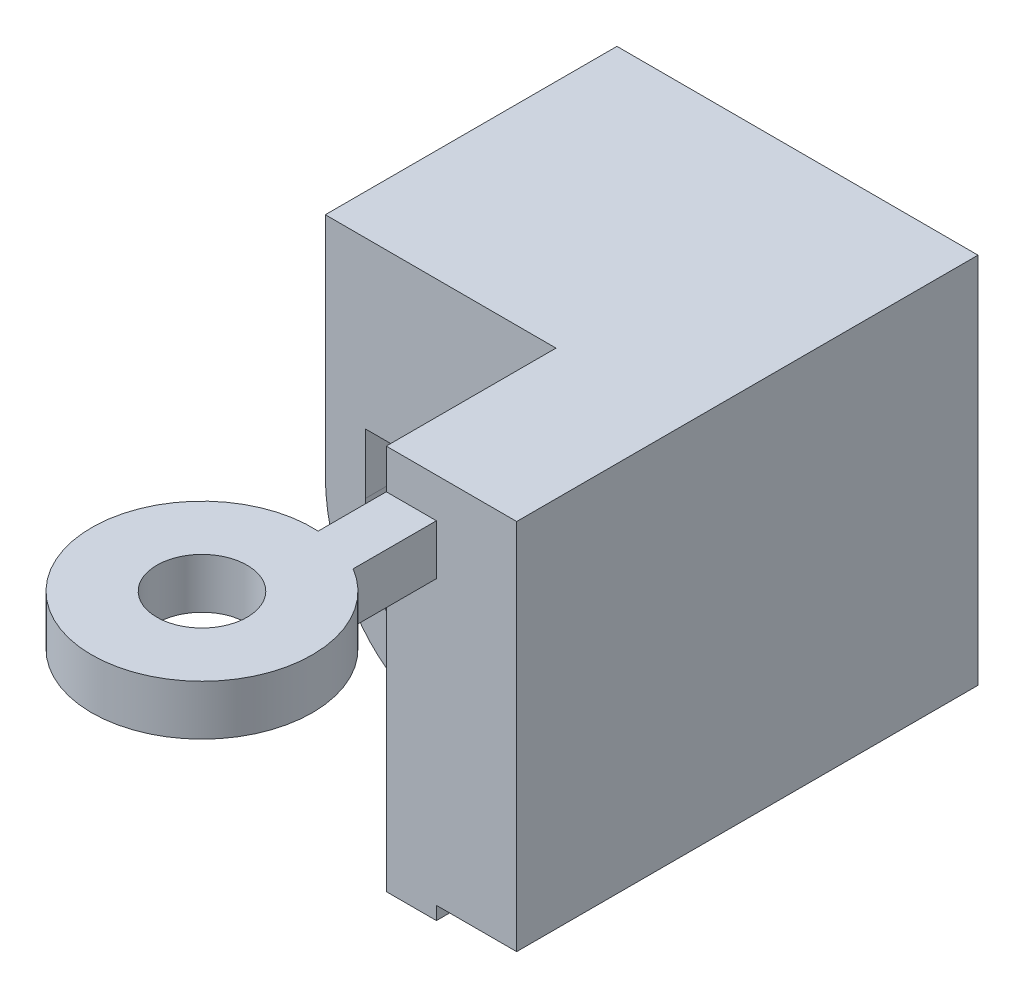
from build123d import *

# Parameters (mm, degrees)
BOSS_EXTRUDE1_DEPTH     = 46
SKETCH3_W               = 23
SKETCH3_H               = 15
CUT_EXTRUDE2_DEPTH      = 28
CUT_EXTRUDE6_DEPTH      = 40
CUT_EXTRUDE6_DEPTH_BACK = 30
SKETCH10_W              = 22.999996183
SKETCH10_H              = 16.921181255
SKETCH7_R               = 11
SKETCH7_R_2             = 4.5
BOSS_EXTRUDE2_DEPTH     = 5
BOSS_EXTRUDE3_DEPTH     = 5


with BuildPart() as part:
    # Sketch1 → Boss-Extrude1 (new body)
    with BuildSketch(Plane.XY):
        with BuildLine():
            Line((-22.718454064, 23.966100395), (13.281542119, 23.93479699))
            Line((13.281542119, 23.93479699), (13.281542119, -13.210798183))
            Line((13.281542119, -13.210798183), (5.281545459, -13.210798183))
            Line((5.281545459, -13.210798183), (5.281545459, -14.529188453))
            Line((5.281545459, -14.529188453), (-9.718454064, -14.529188453))
            ThreePointArc((-9.718454064, -14.529188453), (-14.925713646, -13.200176165), (-19.056981743, -9.762960731))
            ThreePointArc((-19.056981743, -9.762960731), (-21.779979177, -4.437922335), (-22.718454064, 1.468854607))
            Line((-22.718454064, 1.468854607), (-22.718454064, 23.966100395))
        make_face()
        with BuildLine():
            Line((-18.718455971, 7.468114556), (0.281544029, 7.468114556))
            Line((0.281544029, 7.468114556), (0.281544029, -11.529558479))
            Line((0.281544029, -11.529558479), (-9.718454064, -11.529558479))
            ThreePointArc((-9.718454064, -11.529558479), (-13.398330557, -10.623193541), (-16.168405236, -8.036752998))
            ThreePointArc((-16.168405236, -8.036752998), (-18.168441603, -3.478446477), (-18.718455971, 1.468854607))
            Line((-18.718455971, 1.468854607), (-18.718455971, 7.468114556))
        make_face(mode=Mode.SUBTRACT)
    extrude(amount=BOSS_EXTRUDE1_DEPTH)

    # Sketch3 → Cut-Extrude2 (cut)
    with BuildSketch(Plane.XZ.offset(14.529188453)):
        with Locations((-11.2030368, 14.578818745)):
            Rectangle(SKETCH3_W, SKETCH3_H)
    extrude(amount=-CUT_EXTRUDE2_DEPTH, mode=Mode.SUBTRACT)

    # Sketch10 → Cut-Extrude6 (cut, two sides: drawn at the far end of the back side and taken through both)
    with BuildSketch(Plane(origin=(0, 7.468114556, 0), x_dir=(-1, 0, 0), z_dir=(0, -1, 0)).offset(-CUT_EXTRUDE6_DEPTH_BACK)):
        with Locations((11.218455973, -37.539409373)):
            Rectangle(SKETCH10_W, SKETCH10_H)
    extrude(amount=CUT_EXTRUDE6_DEPTH + CUT_EXTRUDE6_DEPTH_BACK, mode=Mode.SUBTRACT)



with BuildPart() as body_2:
    # Sketch7 → Boss-Extrude2 (new body)
    with BuildSketch(Plane(origin=(0, 20, 0), x_dir=(1, 0, 0), z_dir=(0, 1, 0))):
        with Locations(Location((-0.321447284, -63.773621976, 0), (0, 0, 270))):
            Circle(SKETCH7_R)
        with Locations(Location((-0.321447284, -63.773621976, 0), (0, 0, 270))):
            Circle(SKETCH7_R_2, mode=Mode.SUBTRACT)
    extrude(amount=-BOSS_EXTRUDE2_DEPTH)


with BuildPart() as part_1:
    add(part.part)

    add(body_2.part)  # Boss-Extrude3 merges body 2
    # Sketch12 → Boss-Extrude3 (add)
    with BuildSketch(Plane(origin=(0, 20, 0), x_dir=(1, 0, 0), z_dir=(0, 1, 0))):
        with BuildLine():
            Line((0.281542119, -46), (0.281542119, -52.790161511))
            ThreePointArc((0.281542119, -52.790161511), (2.872949751, -53.247662277), (5.281545459, -54.307552448))
            Line((5.281545459, -54.307552448), (5.281545459, -46))
            Line((5.281545459, -46), (0.281542119, -46))
        make_face()
    extrude(amount=-BOSS_EXTRUDE3_DEPTH)


solid = part_1.part
